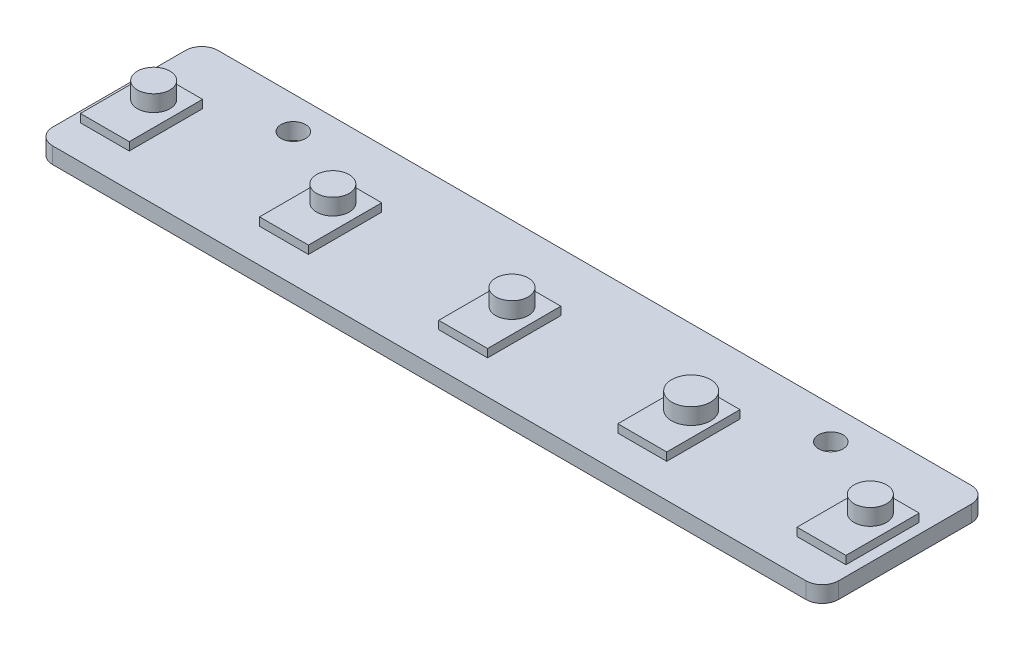
from build123d import *

# Parameters (mm, degrees)
EXTRUDE_2_DEPTH          = 2
CUT_EXTRUDE_3_DEPTH      = 50.346580429
CUT_EXTRUDE_3_DEPTH_BACK = 50.346580429
SKETCH_2_R               = 1.5
SKETCH_3_W               = 6
SKETCH_3_H               = 9
EXTRUDE_3_DEPTH          = 3
EXTRUDE_START            = 3
SKETCH_4_R               = 2
SKETCH_4_R_2             = 2.38964589
EXTRUDE_4_DEPTH          = 2


with BuildPart() as part:
    # 草图1 → 凸台-拉伸2 (new body)
    with BuildSketch(Plane(origin=(0, 0, 0), x_dir=(1, 0, 0), z_dir=(0, 1, 0))):
        with BuildLine():
            Line((46.25, -10.15), (-46.25, -10.15))
            ThreePointArc((-46.25, -10.15), (-47.664213562, -9.564213562), (-48.25, -8.15))
            Line((-48.25, -8.15), (-48.25, 8.15))
            ThreePointArc((-48.25, 8.15), (-47.664213562, 9.564213562), (-46.25, 10.15))
            Line((-46.25, 10.15), (46.25, 10.15))
            ThreePointArc((46.25, 10.15), (47.664213562, 9.564213562), (48.25, 8.15))
            Line((48.25, 8.15), (48.25, -8.15))
            ThreePointArc((48.25, -8.15), (47.664213562, -9.564213562), (46.25, -10.15))
        make_face()
    extrude(amount=EXTRUDE_2_DEPTH)

    # 草图2 → 切除-拉伸3 (cut, two sides: drawn at the far end of the back side and taken through both)
    with BuildSketch(Plane(origin=(0, 0, 0), x_dir=(1, 0, 0), z_dir=(0, 1, 0)).offset(-CUT_EXTRUDE_3_DEPTH_BACK)):
        with Locations(Location((-33, 6.15, 0), (0, 0, 270))):
            Circle(SKETCH_2_R)
        with Locations(Location((33, 6.15, 0), (0, 0, 270))):
            Circle(SKETCH_2_R)
    extrude(amount=CUT_EXTRUDE_3_DEPTH + CUT_EXTRUDE_3_DEPTH_BACK, mode=Mode.SUBTRACT)

    # 草图3 → 凸台-拉伸3 (add)
    with BuildSketch(Plane(origin=(0, 0, 0), x_dir=(1, 0, 0), z_dir=(0, 1, 0))):
        with Locations((-44, -1.5)):
            Rectangle(SKETCH_3_W, SKETCH_3_H)
        with Locations((-22, -1.5)):
            Rectangle(SKETCH_3_W, SKETCH_3_H)
        with Locations((0, -1.5)):
            Rectangle(SKETCH_3_W, SKETCH_3_H)
        with Locations((22, -1.5)):
            Rectangle(SKETCH_3_W, SKETCH_3_H)
        with Locations((44, -1.5)):
            Rectangle(SKETCH_3_W, SKETCH_3_H)
    extrude(amount=EXTRUDE_3_DEPTH)

    # 草图4 → 凸台-拉伸4 (add)
    with BuildSketch(Plane(origin=(0, 0, 0), x_dir=(1, 0, 0), z_dir=(0, 1, 0)).offset(EXTRUDE_START)):
        with Locations(Location((-44, 0, 0), (0, 0, 90))):
            Circle(SKETCH_4_R)
        with Locations(Location((-22, 0, 0), (0, 0, 90))):
            Circle(SKETCH_4_R)
        with Locations(Location((0, 0, 0), (0, 0, 90))):
            Circle(SKETCH_4_R)
        with Locations(Location((22, 0, 0), (0, 0, 90))):
            Circle(SKETCH_4_R_2)
        with Locations(Location((44, 0, 0), (0, 0, 90))):
            Circle(SKETCH_4_R)
    extrude(amount=EXTRUDE_4_DEPTH)


solid = part.part
